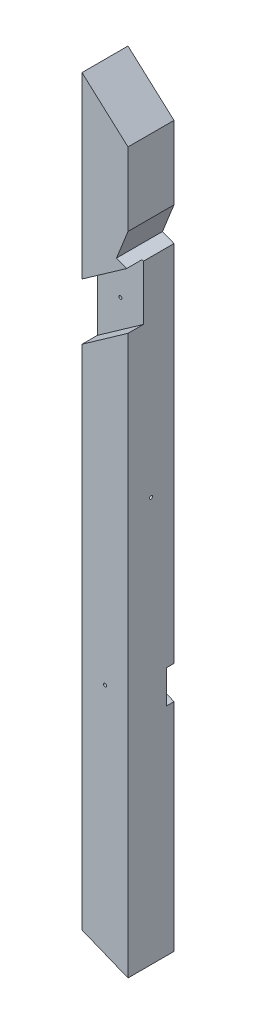
from build123d import *

# Parameters (mm, degrees)
SKETCH1_W           = 150
SKETCH1_H           = 150
BOSS_EXTRUDE1_DEPTH = 1250
SKETCH2_R           = 5
CUT_EXTRUDE1_DEPTH  = 1262.199825563
ROOFCUT_DEPTH       = 1262.199825563
TOPCUT_DEPTH        = 1262.199825563
SKETCH5_R           = 5
CUT_EXTRUDE4_DEPTH  = 1262.199825563
CUT_EXTRUDE5_DEPTH  = 50
CUT_EXTRUDE6_DEPTH  = 25
CUT_EXTRUDE7_DEPTH  = 1262.199825563


with BuildPart() as part:
    # Sketch1 → Boss-Extrude1 (new, symmetric)
    with BuildSketch(Plane(origin=(0, 0, 0), x_dir=(1, 0, 0), z_dir=(0, 1, 0))):
        Rectangle(SKETCH1_W, SKETCH1_H)
    extrude(amount=BOSS_EXTRUDE1_DEPTH, both=True)

    # Sketch2 → Cut-Extrude1 (cut, through all)
    with BuildSketch(Plane.XY.offset(75)):
        with Locations((0, 610)):
            Circle(SKETCH2_R)
        with Locations((0, -460)):
            Circle(SKETCH2_R)
    extrude(amount=-CUT_EXTRUDE1_DEPTH, mode=Mode.SUBTRACT)

    # Sketch3 → RoofCut (cut, through all)
    with BuildSketch(Plane.XY.offset(75)):
        Polygon((-75, 1232.703797136), (75, 1097.593747534), (75, 1250), (-75, 1250), align=None)
    extrude(amount=-ROOFCUT_DEPTH, mode=Mode.SUBTRACT)

    # Sketch4 → TopCut (cut, through all)
    with BuildSketch(Plane.XY.offset(75)):
        Polygon((75, 858.878428235), (37.522465852, 764.870707964), (75, 749.720866047), align=None)
    extrude(amount=-TOPCUT_DEPTH, mode=Mode.SUBTRACT)

    # Sketch5 → Cut-Extrude4 (cut, through all)
    with BuildSketch(Plane(origin=(75, 0, 0), x_dir=(0, 0, -1), z_dir=(1, 0, 0))):
        with Locations((0, 70)):
            Circle(SKETCH5_R)
    extrude(amount=-CUT_EXTRUDE4_DEPTH, mode=Mode.SUBTRACT)

    # Sketch7 → Cut-Extrude5 (cut)
    with BuildSketch(Plane.XY.offset(75)):
        Polygon((-75, 649.486666068), (-75, 465.302341615), (75, 571.125839473), (75, 754.950569225), align=None)
    extrude(amount=-CUT_EXTRUDE5_DEPTH, mode=Mode.SUBTRACT)

    # Sketch8 → Cut-Extrude6 (cut)
    with BuildSketch(Plane(origin=(0, 0, -75), x_dir=(-1, 0, 0), z_dir=(0, 0, -1))):
        Polygon((-78.608377022, -545.707193758), (75, -483.612856927), (75, -375.751449205), (-75, -436.387143073), align=None)
    extrude(amount=-CUT_EXTRUDE6_DEPTH, mode=Mode.SUBTRACT)

    # Sketch9 → Cut-Extrude7 (cut, through all)
    with BuildSketch(Plane.XY.offset(75)):
        Polygon((-75, -1189.364306132), (75, -1250), (-75, -1250), align=None)
    extrude(amount=-CUT_EXTRUDE7_DEPTH, mode=Mode.SUBTRACT)


solid = part.part
